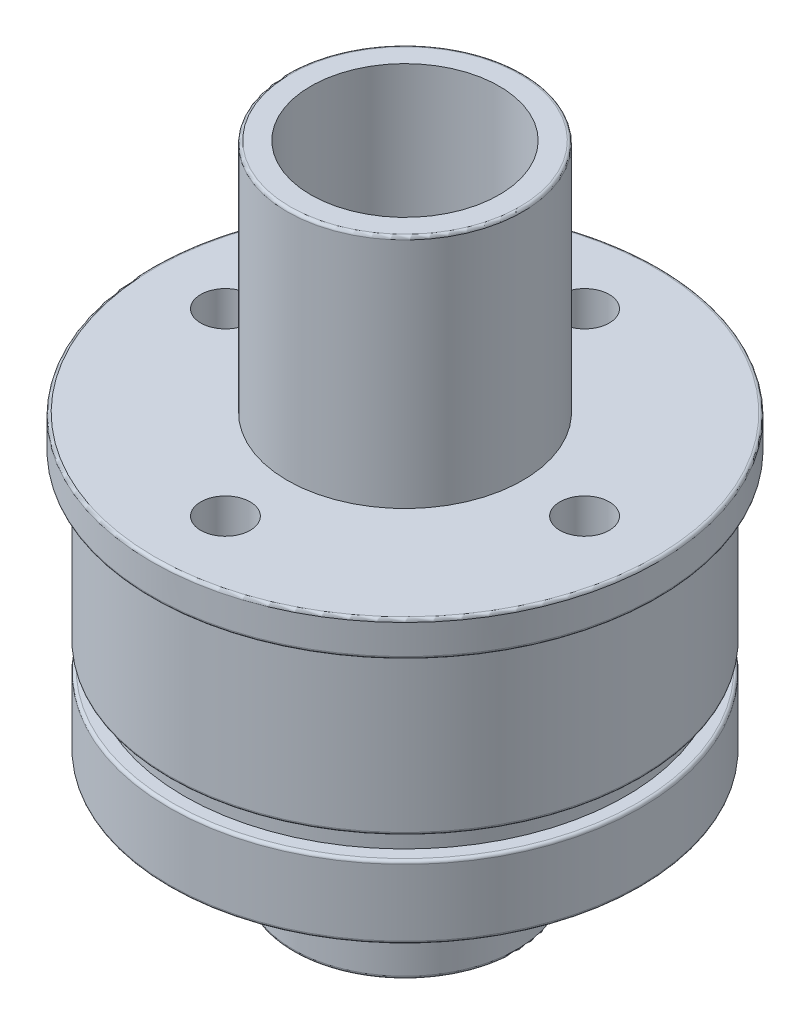
from build123d import *

# Parameters (mm, degrees)
SKETCH1_W                            = 21.5
SKETCH1_H                            = 3
SKETCH2_R                            = 20
BOSS_EXTRUDE1_DEPTH                  = 17
SKETCH3_R                            = 9.5
BOSS_EXTRUDE2_DEPTH                  = 15
SKETCH4_R                            = 10
BOSS_EXTRUDE3_DEPTH                  = 20
SKETCH8_R                            = 20
SKETCH8_R_2                          = 9.5
BOSS_EXTRUDE4_DEPTH                  = 5
FILLET1_R                            = 0.25
SKETCH17_R                           = 29.12148471
SKETCH17_R_2                         = 18.75
CUT_EXTRUDE4_DEPTH                   = 1.85
FILLET6_R                            = 0.25
M5_GEWINDEBOHRUNG2_AT_2_COUNT        = 2
M5_GEWINDEBOHRUNG2_AT_2_PITCH        = 14.849242405
M5_GEWINDEBOHRUNG2_AT_3_COUNT        = 2
M5_GEWINDEBOHRUNG2_AT_3_PITCH        = 14.849242405
M5_GEWINDEBOHRUNG2_AT_4_COUNT        = 2
M5_GEWINDEBOHRUNG2_AT_4_PITCH        = 14.849242405
M5_GEWINDEBOHRUNG2_AT_5_COUNT        = 2
M5_GEWINDEBOHRUNG2_AT_5_PITCH        = 14.849242405
M5_GEWINDEBOHRUNG1_D                 = 4.2
M5_GEWINDEBOHRUNG1_DEPTH             = 20
M5_GEWINDEBOHRUNG1_TIP               = 1.2618073
SCHNITT_LINEAR_AUSTRAGEN1_DEPTH      = 63.845047694
SCHNITT_LINEAR_AUSTRAGEN1_DEPTH_BACK = 63.845047694
SKIZZE6_R                            = 8


with BuildPart() as part:
    # Sketch1 → Revolve1 (revolve)
    with BuildSketch(Plane.XY, mode=Mode.PRIVATE) as revolve1_sk:
        with Locations((10.75, 47.5)):
            Rectangle(SKETCH1_W, SKETCH1_H)
    revolve(revolve1_sk.sketch.rotate(Axis((0, 49, 0), (0, -1, 0)), 270), axis=Axis((0, 49, 0), (0, -1, 0)))

    # Sketch2 → Boss-Extrude1 (add)
    with BuildSketch(Plane.XZ.offset(-46)):
        with Locations(Location((0, 0, 0), (0, 0, 270))):
            Circle(SKETCH2_R)
    extrude(amount=BOSS_EXTRUDE1_DEPTH)

    # Sketch3 → Boss-Extrude2 (add)
    with BuildSketch(Plane.XZ.offset(-29)):
        with Locations(Location((0, 0, 0), (0, 0, 270))):
            Circle(SKETCH3_R)
    extrude(amount=BOSS_EXTRUDE2_DEPTH)

    # Sketch4 → Boss-Extrude3 (add)
    with BuildSketch(Plane(origin=(0, 49, 0), x_dir=(-1, 0, 0), z_dir=(0, 1, 0))):
        with Locations(Location((0, 0, 0), (0, 0, 90))):
            Circle(SKETCH4_R)
    extrude(amount=BOSS_EXTRUDE3_DEPTH)

    # Sketch8 → Boss-Extrude4 (add)
    with BuildSketch(Plane.XZ.offset(-29)):
        with Locations(Location((0, 0, 0), (0, 0, 270))):
            Circle(SKETCH8_R)
        with Locations(Location((0, 0, 0), (0, 0, 270))):
            Circle(SKETCH8_R_2, mode=Mode.SUBTRACT)
    extrude(amount=BOSS_EXTRUDE4_DEPTH)

    # Fillet1
    fillet1_edges = [part.edges().sort_by_distance(p)[0] for p in [
        (0, 69, -10),
        (0, 24, 20),
        (0, 46, 21.5),
        (0, 49, 21.5),
    ]]
    fillet(fillet1_edges, radius=FILLET1_R)

    # Sketch17 → Cut-Extrude4 (cut)
    with BuildSketch(Plane(origin=(0, 32, 0), x_dir=(-1, 0, 0), z_dir=(0, -1, 0))):
        Circle(SKETCH17_R)
        with Locations(Location((0, 0, 0), (0, 0, 90))):
            Circle(SKETCH17_R_2, mode=Mode.SUBTRACT)
    extrude(amount=CUT_EXTRUDE4_DEPTH, mode=Mode.SUBTRACT)

    # Fillet6
    fillet6_edges = [part.edges().sort_by_distance(p)[0] for p in [
        (0, 14, 9.5),
        (0, 30.15, 20),
        (0, 32, 20),
    ]]
    fillet(fillet6_edges, radius=FILLET6_R)

    # Skizze2 → M5 Gewindebohrung2 (revolve, cut)
    with BuildSketch(Plane(origin=(0, 24, 0), x_dir=(0, 0, -1), z_dir=(1, 0, 0))):
        Polygon((0, 0), (0, 13.6618073), (2.1, 12.4), (2.1, 0.425), (2.525, 0), align=None)
    m5_gewindebohrung2 = revolve(axis=Axis((0, 17.65, 0), (0, 1, 0)), mode=Mode.SUBTRACT)

    # M5 Gewindebohrung2 at 2: M5 Gewindebohrung2 ×2
    with Locations(*[Vector(0.7071067811865475, 0, 0.7071067811865476) * (i * M5_GEWINDEBOHRUNG2_AT_2_PITCH) for i in range(1, M5_GEWINDEBOHRUNG2_AT_2_COUNT)]):
        add(m5_gewindebohrung2, mode=Mode.SUBTRACT)

    # M5 Gewindebohrung2 at 3: M5 Gewindebohrung2 ×2
    with Locations(*[Vector(-0.7071067811865475, 0, -0.7071067811865477) * (i * M5_GEWINDEBOHRUNG2_AT_3_PITCH) for i in range(1, M5_GEWINDEBOHRUNG2_AT_3_COUNT)]):
        add(m5_gewindebohrung2, mode=Mode.SUBTRACT)

    # M5 Gewindebohrung2 at 4: M5 Gewindebohrung2 ×2
    with Locations(*[Vector(-0.7071067811865474, 0, 0.7071067811865477) * (i * M5_GEWINDEBOHRUNG2_AT_4_PITCH) for i in range(1, M5_GEWINDEBOHRUNG2_AT_4_COUNT)]):
        add(m5_gewindebohrung2, mode=Mode.SUBTRACT)

    # M5 Gewindebohrung2 at 5: M5 Gewindebohrung2 ×2
    with Locations(*[Vector(0.7071067811865479, 0, -0.7071067811865472) * (i * M5_GEWINDEBOHRUNG2_AT_5_PITCH) for i in range(1, M5_GEWINDEBOHRUNG2_AT_5_COUNT)]):
        add(m5_gewindebohrung2, mode=Mode.SUBTRACT)

    # M5 Gewindebohrung1
    with Locations(Plane(origin=(0, 49, 0), x_dir=(1, 0, 0), z_dir=(0, 1, 0))):
        with Locations((-15.25, 0), (29.07342828, 17.079916614), (0, 15.25), (15.25, 0), (0, -15.25)):
            Hole(M5_GEWINDEBOHRUNG1_D / 2, depth=M5_GEWINDEBOHRUNG1_DEPTH)
            with Locations((0, 0, -(M5_GEWINDEBOHRUNG1_DEPTH + M5_GEWINDEBOHRUNG1_TIP / 2))):  # 118° drill point
                Cone(0, M5_GEWINDEBOHRUNG1_D / 2, M5_GEWINDEBOHRUNG1_TIP, mode=Mode.SUBTRACT)

    # Skizze5 → Schnitt-Rotation1 (revolve, cut)
    with BuildSketch(Plane.XY, mode=Mode.PRIVATE) as schnitt_rotation1_sk:
        Polygon((8, 69), (8, 39), (7, 39), (7, 14), (0, 14), (0, 69), align=None)
    revolve(schnitt_rotation1_sk.sketch.rotate(Axis((0, 62.765428039, 0), (0, -1, 0)), 90), axis=Axis((0, 62.765428039, 0), (0, -1, 0)), mode=Mode.SUBTRACT)

    # Skizze6 → Schnitt-Linear austragen1 (cut, two sides: drawn at the far end of the back side and taken through both)
    with BuildSketch(Plane(origin=(0, 69, 0), x_dir=(1, 0, 0), z_dir=(0, 1, 0)).offset(-SCHNITT_LINEAR_AUSTRAGEN1_DEPTH_BACK)):
        with Locations(Location((0, 0, 0), (0, 0, 270))):
            Circle(SKIZZE6_R)
    extrude(amount=SCHNITT_LINEAR_AUSTRAGEN1_DEPTH + SCHNITT_LINEAR_AUSTRAGEN1_DEPTH_BACK, mode=Mode.SUBTRACT)


solid = part.part
